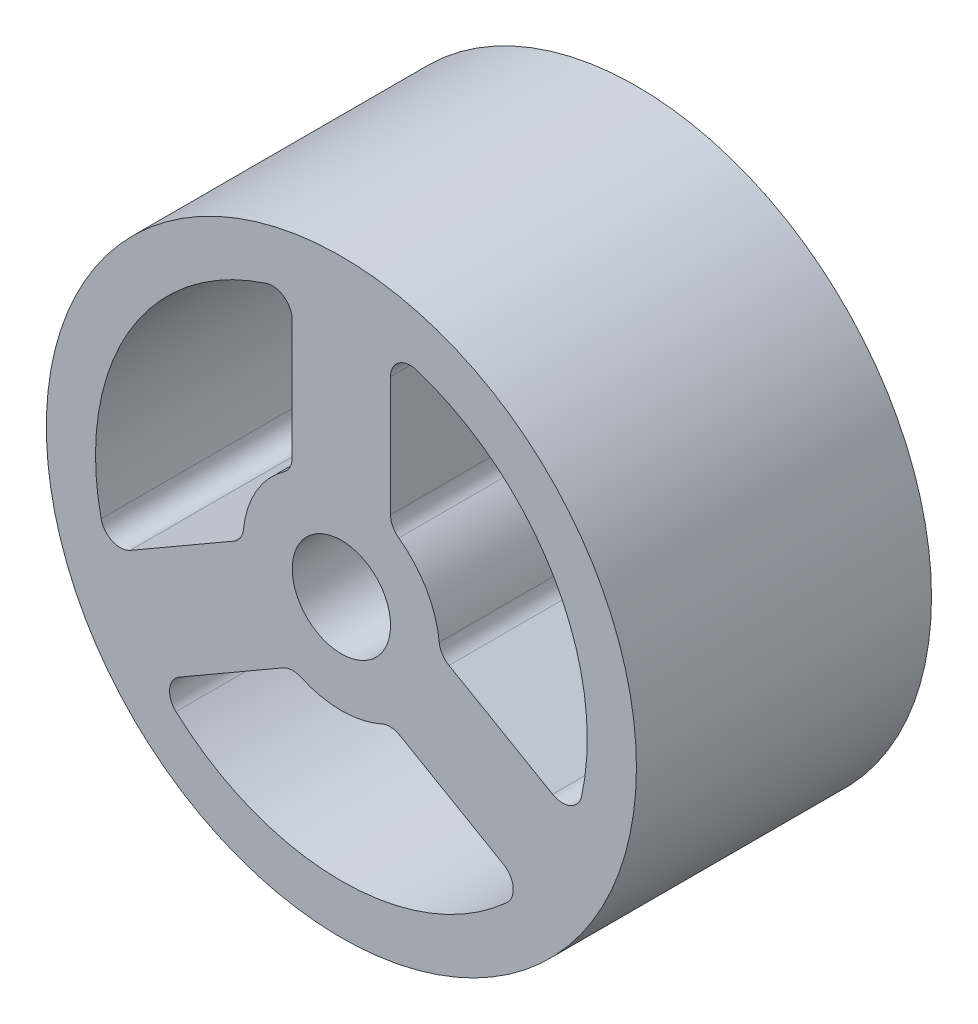
from build123d import *

# Parameters (mm, degrees)
SKETCH1_R           = 30
SKETCH1_R_2         = 25
SKETCH1_R_3         = 10
SKETCH1_R_4         = 5
BOSS_EXTRUDE1_DEPTH = 30


with BuildPart() as part:
    # Sketch1 → Boss-Extrude1 (new body)
    # profile 1 of 5: a face of its own
    with BuildSketch(Plane.XY):
        Circle(SKETCH1_R)
        Circle(SKETCH1_R_2, mode=Mode.SUBTRACT)
    # profile 2 of 5: a face of its own
    with BuildSketch(Plane.XY):
        with BuildLine():
            ThreePointArc((-7.608695652, 23.814024239), (-5.820464351, 23.524048006), (-5, 21.9089023))
            Line((-5, 21.9089023), (-5, 9.746794345))
            ThreePointArc((-5, 9.746794345), (-5.220486958, 8.833923416), (-5.833333333, 8.122328621))
            ThreePointArc((-5.833333333, 8.122328621), (0, 10), (5.833333333, 8.122328621))
            ThreePointArc((5.833333333, 8.122328621), (5.220486958, 8.833923416), (5, 9.746794345))
            Line((5, 9.746794345), (5, 21.9089023))
            ThreePointArc((5, 21.9089023), (5.820464351, 23.524048006), (7.608695652, 23.814024239))
            ThreePointArc((7.608695652, 23.814024239), (0, 25), (-7.608695652, 23.814024239))
        make_face()
    # profile 3 of 5: a face of its own
    with BuildSketch(Plane.XY):
        with BuildLine():
            ThreePointArc((-21.473665961, -6.624324131), (-23.282655349, -6.721354014), (-24.427897784, -5.317688395))
            ThreePointArc((-24.427897784, -5.317688395), (-21.650635095, -12.5), (-16.819202132, -18.496335844))
            ThreePointArc((-16.819202132, -18.496335844), (-17.462190998, -16.802693993), (-16.473665961, -15.284578169))
            Line((-16.473665961, -15.284578169), (-5.940971508, -9.203524191))
            ThreePointArc((-5.940971508, -9.203524191), (-5.040158614, -8.938036034), (-4.117476257, -9.112979166))
            ThreePointArc((-4.117476257, -9.112979166), (-8.660254038, -5), (-9.95080959, 0.990650545))
            ThreePointArc((-9.95080959, 0.990650545), (-10.260645572, 0.104112618), (-10.940971508, -0.543270153))
            Line((-10.940971508, -0.543270153), (-21.473665961, -6.624324131))
        make_face()
    # profile 4 of 5: a face of its own
    with BuildSketch(Plane.XY):
        with BuildLine():
            ThreePointArc((10.940971508, -0.543270153), (10.260645572, 0.104112618), (9.95080959, 0.990650545))
            ThreePointArc((9.95080959, 0.990650545), (9.987694827, 0.49593553), (10, 0))
            ThreePointArc((10, 0), (8.40162968, -5.423340181), (4.117476257, -9.112979166))
            ThreePointArc((4.117476257, -9.112979166), (5.040158614, -8.938036034), (5.940971508, -9.203524191))
            Line((5.940971508, -9.203524191), (16.473665961, -15.284578169))
            ThreePointArc((16.473665961, -15.284578169), (17.462190998, -16.802693993), (16.819202132, -18.496335844))
            ThreePointArc((16.819202132, -18.496335844), (21.650635095, -12.5), (24.427897784, -5.317688395))
            ThreePointArc((24.427897784, -5.317688395), (23.282655349, -6.721354014), (21.473665961, -6.624324131))
            Line((21.473665961, -6.624324131), (10.940971508, -0.543270153))
        make_face()
    # profile 5 of 5: a face of its own
    with BuildSketch(Plane.XY):
        Circle(SKETCH1_R_3)
        Circle(SKETCH1_R_4, mode=Mode.SUBTRACT)
    extrude(amount=BOSS_EXTRUDE1_DEPTH)


solid = part.part
